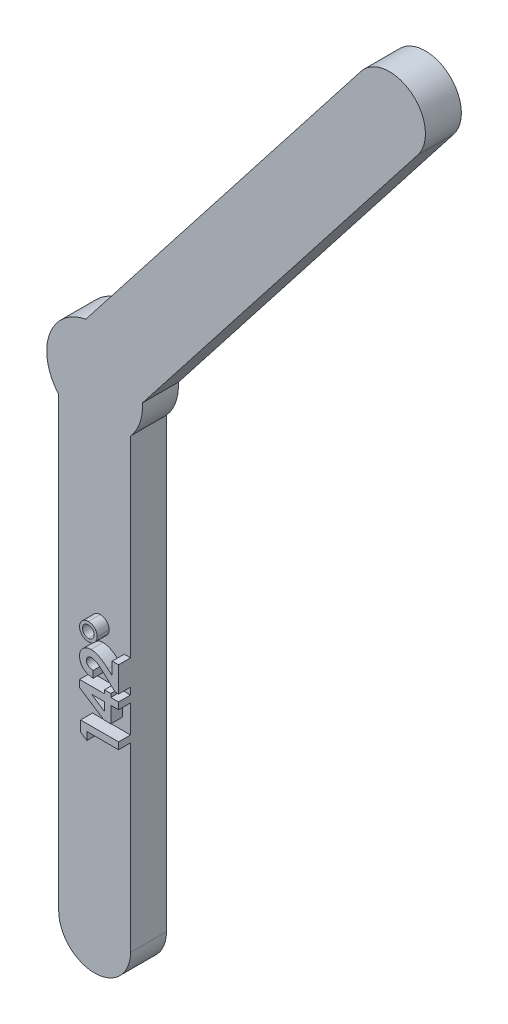
from build123d import *

# Parameters (mm, degrees)
BOSS_EXTRUDE1_DEPTH = 3
BOSS_EXTRUDE2_DEPTH = 1


with BuildPart() as part:
    # Sketch2 → Boss-Extrude1 (new body)
    with BuildSketch(Plane.XY):
        with BuildLine():
            Line((-3, -40), (-3, -2.645751311))
            ThreePointArc((-3, -2.645751311), (-3.782074302, 1.302272618), (-0.735145105, 3.93186491))
            Line((-0.735145105, 3.93186491), (22.262426752, 33.36741457))
            ThreePointArc((22.262426752, 33.36741457), (26.473443439, 33.884462405), (26.990491274, 29.673445718))
            Line((26.990491274, 29.673445718), (3.992919416, 0.237896059))
            ThreePointArc((3.992919416, 0.237896059), (3.782074302, -1.302272618), (3, -2.645751311))
            Line((3, -2.645751311), (3, -40))
            ThreePointArc((3, -40), (0, -43), (-3, -40))
        make_face()
    extrude(amount=BOSS_EXTRUDE1_DEPTH)

    # Sketch3 → Boss-Extrude2 (add)
    # profile 1 of 4: a face of its own
    with BuildSketch(Plane.XY.offset(3)):
        Polygon((-0.175, -25.154881865), (-0.175, -24.27399745), (3, -24.27399745), (3, -24.843869245), (0.354166667, -24.843869245), (0.354166667, -25.495151297), align=None)
    # profile 2 of 4: a face of its own
    with BuildSketch(Plane.XY.offset(3)):
        Polygon((-0.256410256, -21.977973813), (-0.256410256, -21.383933348), (1.819551282, -21.383933348), (1.819551282, -21.09899745), (2.348717949, -21.09899745), (2.348717949, -21.383933348), (3, -21.383933348), (3, -21.953805143), (2.348717949, -21.953805143), (2.348717949, -23.297074373), (1.77184996, -23.297074373), align=None)
        Polygon((1.819551282, -21.953805143), (0.738957332, -21.953805143), (1.819551282, -22.656604622), align=None, mode=Mode.SUBTRACT)
    # profile 3 of 4: a face of its own
    with BuildSketch(Plane.XY.offset(3)):
        with BuildLine():
            Line((0.883333333, -20.162779502), (0.883333333, -20.732651297))
            add(Edge.make_bspline(
                [(0.883333333, -20.732651297), (0.840225096, -20.730191074), (0.755994188, -20.725383947), (0.633653662, -20.706241436), (0.518027034, -20.680657038), (0.40946192, -20.646219807), (0.307912712, -20.60380263), (0.213715784, -20.552349795), (0.126196171, -20.493397498), (0.046888793, -20.425757446), (-0.024410951, -20.352174821), (-0.086743059, -20.272838264), (-0.138923185, -20.187973141), (-0.181726781, -20.098146926), (-0.21597517, -20.003712445), (-0.238860935, -19.903715573), (-0.254362753, -19.79903865), (-0.255719005, -19.727378184), (-0.256410256, -19.690854422)],
                knots=[0, 0, 0, 0, 1.198928049, 2.342633425, 3.435730849, 4.486331048, 5.502589352, 6.488331875, 7.46361919, 8.428949135, 9.378681775, 10.305958057, 11.226249248, 12.140413166, 13.066341608, 14.010670971, 14.986082777, 16, 16, 16, 16], degree=3))
            add(Edge.make_bspline(
                [(-0.256410256, -19.690854422), (-0.255105406, -19.646001889), (-0.252556912, -19.558400759), (-0.227944491, -19.43153247), (-0.1902546, -19.312410398), (-0.135496388, -19.202301662), (-0.066445841, -19.101397701), (0.016045912, -19.010259508), (0.112981004, -18.930664566), (0.22156795, -18.863233626), (0.336775889, -18.807471791), (0.455688105, -18.768021196), (0.575235528, -18.742227374), (0.655723183, -18.739469888), (0.695708133, -18.738100015)],
                knots=[0, 0, 0, 0, 1.075374184, 2.100304875, 3.089917907, 4.066149699, 5.039978333, 6.01615708, 7.006437042, 8.039858286, 9.077679641, 10.07047942, 11.041445745, 12, 12, 12, 12], degree=3))
            add(Edge.make_bspline(
                [(0.695708133, -18.738100015), (0.719894323, -18.738632687), (0.76857515, -18.739704825), (0.842241189, -18.747159544), (0.91727866, -18.758343098), (0.993623236, -18.77520516), (1.071296278, -18.796233582), (1.15053039, -18.821743906), (1.23087573, -18.852328775), (1.313238994, -18.887474255), (1.397877871, -18.929414737), (1.48610119, -18.978199927), (1.57781503, -19.035460826), (1.673918976, -19.099333418), (1.77294563, -19.172330469), (1.875994606, -19.252518354), (1.982903527, -19.34030072), (2.054398515, -19.402554777), (2.091130809, -19.434539317)],
                knots=[0, 0, 0, 0, 0.728277616, 1.465842947, 2.227925269, 3.011838508, 3.818735656, 4.650581052, 5.517389122, 6.406849312, 7.346234817, 8.360743166, 9.441530624, 10.601362564, 11.834937575, 13.145232671, 14.533293658, 16, 16, 16, 16], degree=3))
            Line((2.091130809, -19.434539317), (2.470833333, -19.765904502))
            Line((2.470833333, -19.765904502), (2.470833333, -18.697394886))
            Line((2.470833333, -18.697394886), (3, -18.697394886))
            Line((3, -18.697394886), (3, -20.814061553))
            Line((3, -20.814061553), (2.711247997, -20.814061553))
            Line((2.711247997, -20.814061553), (1.710792268, -19.874027498))
            add(Edge.make_bspline(
                [(1.710792268, -19.874027498), (1.681608954, -19.846810666), (1.625089529, -19.794099733), (1.542079999, -19.719104506), (1.46332294, -19.651215475), (1.38790503, -19.591950629), (1.318379822, -19.537724275), (1.252118997, -19.492359941), (1.190988578, -19.452853164), (1.116473028, -19.411584162), (1.028271209, -19.371490235), (0.9267219, -19.334724743), (0.829596088, -19.312538281), (0.766193513, -19.309452269), (0.735777244, -19.307971809)],
                knots=[0, 0, 0, 0, 1.246192343, 2.413505005, 3.49357156, 4.492416076, 5.408771964, 6.246246772, 6.999304986, 7.680960093, 8.904522682, 10.020616941, 11.0504258, 12, 12, 12, 12], degree=3))
            add(Edge.make_bspline(
                [(0.735777244, -19.307971809), (0.706350798, -19.309075792), (0.649332342, -19.311214936), (0.568223891, -19.334722394), (0.494788469, -19.371140964), (0.431220409, -19.422459871), (0.378982318, -19.484623141), (0.340129094, -19.556458639), (0.317710962, -19.637380694), (0.314905012, -19.694108596), (0.313461538, -19.723291321)],
                knots=[0, 0, 0, 0, 1.062038974, 2.057870785, 3.028805853, 4.01125022, 4.991535629, 5.949134679, 6.94496649, 8, 8, 8, 8], degree=3))
            add(Edge.make_bspline(
                [(0.313461538, -19.723291321), (0.313994775, -19.738367488), (0.315044537, -19.768047344), (0.322032517, -19.811674413), (0.334348102, -19.853188704), (0.350849253, -19.893052293), (0.372721647, -19.930839746), (0.399682857, -19.966455751), (0.431047738, -20.000275568), (0.466718216, -20.032144085), (0.50652648, -20.061148596), (0.550108963, -20.086910297), (0.597438611, -20.108210934), (0.647890602, -20.12696479), (0.70200683, -20.141428661), (0.759463417, -20.151960153), (0.820166887, -20.159966543), (0.861894815, -20.161824791), (0.883333333, -20.162779502)],
                knots=[0, 0, 0, 0, 0.903469896, 1.778625579, 2.63899355, 3.493148037, 4.358286772, 5.247621495, 6.164656832, 7.118446693, 8.109501108, 9.111810964, 10.146451449, 11.215617525, 12.33435995, 13.498009769, 14.714554818, 16, 16, 16, 16], degree=3))
        make_face()
    # profile 4 of 4: a face of its own
    with BuildSketch(Plane.XY.offset(3)):
        with BuildLine():
            add(Edge.make_bspline(
                [(0.476282051, -16.824958989), (0.501543872, -16.825505484), (0.55122174, -16.826580176), (0.624352745, -16.837013476), (0.694208258, -16.854492691), (0.761803607, -16.876903338), (0.825395964, -16.908042089), (0.886396731, -16.944903837), (0.943669883, -16.989402672), (0.9978957, -17.039014969), (1.047295391, -17.093515132), (1.090947065, -17.151405488), (1.127096601, -17.212864468), (1.157366856, -17.276577248), (1.180332148, -17.343408663), (1.196689885, -17.412864586), (1.20741609, -17.485236986), (1.208449037, -17.534503871), (1.208974359, -17.559559349)],
                knots=[0, 0, 0, 0, 1.048753193, 2.062393874, 3.059725798, 4.03711221, 5.013824111, 5.993903926, 6.992478922, 8.020738441, 9.043061753, 10.043343452, 11.026424807, 11.999358773, 12.968420071, 13.955122655, 14.960044262, 16, 16, 16, 16], degree=3))
            add(Edge.make_bspline(
                [(1.208974359, -17.559559349), (1.208454225, -17.584616682), (1.207431478, -17.633887214), (1.196631189, -17.706233128), (1.180530583, -17.775855144), (1.156529218, -17.842391691), (1.126678292, -17.90615653), (1.090260147, -17.967072817), (1.046482503, -18.024600993), (0.996781055, -18.078582797), (0.942375086, -18.128107638), (0.88420218, -18.171482912), (0.823225465, -18.208946116), (0.758107997, -18.237837437), (0.69067286, -18.261947038), (0.619758864, -18.27798784), (0.545943315, -18.288833106), (0.495615647, -18.289833085), (0.469921875, -18.290343604)],
                knots=[0, 0, 0, 0, 1.037227242, 2.039512271, 3.023626077, 3.993053151, 4.963434463, 5.936395473, 6.927031705, 7.952593414, 8.972234493, 9.969891786, 10.954906455, 11.929570282, 12.915563215, 13.916770353, 14.936449251, 16, 16, 16, 16], degree=3))
            add(Edge.make_bspline(
                [(0.469921875, -18.290343604), (0.445290866, -18.289811451), (0.396869022, -18.288765297), (0.325492116, -18.278103661), (0.256787066, -18.261182775), (0.190979117, -18.23681523), (0.128167681, -18.205730248), (0.067236284, -18.169180135), (0.010175979, -18.123937412), (-0.044275745, -18.073515722), (-0.093962638, -18.018218509), (-0.137555056, -17.95952238), (-0.173973759, -17.89802202), (-0.203993097, -17.834134423), (-0.227847104, -17.767768562), (-0.244158222, -17.698411219), (-0.254789074, -17.626671533), (-0.255866772, -17.577830012), (-0.256410256, -17.553199173)],
                knots=[0, 0, 0, 0, 1.027628768, 2.020204677, 3.0054932, 3.977172113, 4.942988595, 5.928118098, 6.937247537, 7.976812879, 9.023474825, 10.036014018, 11.024160528, 12.002107364, 12.979092523, 13.962271943, 14.972371232, 16, 16, 16, 16], degree=3))
            add(Edge.make_bspline(
                [(-0.256410256, -17.553199173), (-0.255881051, -17.528566172), (-0.254836181, -17.479930408), (-0.244068832, -17.408427146), (-0.227959354, -17.339440503), (-0.203981879, -17.27352423), (-0.173948227, -17.210285117), (-0.137706982, -17.149501332), (-0.093944483, -17.091941849), (-0.043999627, -17.038019265), (0.009956511, -16.987787182), (0.068273488, -16.944627592), (0.128824771, -16.907104674), (0.192846684, -16.877455064), (0.259342082, -16.853394895), (0.329176204, -16.837233977), (0.401748506, -16.826543556), (0.451226198, -16.825491671), (0.476282051, -16.824958989)],
                knots=[0, 0, 0, 0, 1.02774298, 2.029191086, 3.012479778, 3.981238486, 4.951290381, 5.931946007, 6.930416638, 7.964088953, 8.997761269, 10.003308488, 10.98854748, 11.966603007, 12.943696749, 13.935593372, 14.954569896, 16, 16, 16, 16], degree=3))
        make_face()
        with BuildLine():
            add(Edge.make_bspline(
                [(0.479462139, -17.069189758), (0.462471258, -17.069424264), (0.428972226, -17.069886612), (0.379883793, -17.077505977), (0.332524379, -17.088023775), (0.287283463, -17.10328392), (0.24427911, -17.123234284), (0.203398935, -17.147571829), (0.164484674, -17.176174899), (0.128492582, -17.209237523), (0.095853701, -17.245103846), (0.066652511, -17.282897251), (0.042455186, -17.323086522), (0.023016589, -17.365273093), (0.006315159, -17.408801858), (-0.003707976, -17.454711924), (-0.01154919, -17.502263298), (-0.011966436, -17.534718897), (-0.012179487, -17.55129112)],
                knots=[0, 0, 0, 0, 1.061159961, 2.092171217, 3.098605391, 4.092036902, 5.070589041, 6.057187883, 7.061962211, 8.084674938, 9.107387665, 10.090954379, 11.06617917, 12.032717429, 12.99305519, 13.973669989, 14.965331307, 16, 16, 16, 16], degree=3))
            add(Edge.make_bspline(
                [(-0.012179487, -17.55129112), (-0.01157068, -17.568051412), (-0.01036426, -17.601263796), (-0.004409395, -17.650200831), (0.007572839, -17.69685371), (0.022606002, -17.742054962), (0.043122897, -17.784898142), (0.067542797, -17.826391236), (0.096744971, -17.865435361), (0.129769422, -17.902214665), (0.165718261, -17.935960463), (0.204573602, -17.964950546), (0.244977971, -17.990352408), (0.287582445, -18.010455361), (0.331832846, -18.026567734), (0.377821945, -18.038209426), (0.425871214, -18.044356322), (0.458458137, -18.045521173), (0.475010016, -18.046112835)],
                knots=[0, 0, 0, 0, 1.042034071, 2.064906527, 3.055369705, 4.030203466, 5.020228521, 6.000742353, 7.017744738, 8.043920206, 9.069249762, 10.075703201, 11.051782302, 12.029903876, 12.99669358, 13.974371501, 14.971122288, 16, 16, 16, 16], degree=3))
            add(Edge.make_bspline(
                [(0.475010016, -18.046112835), (0.491349767, -18.045520146), (0.523514051, -18.044353455), (0.570936909, -18.038223162), (0.616468237, -18.026465839), (0.660506807, -18.010425399), (0.703332854, -17.990458383), (0.743356347, -17.964229259), (0.782721478, -17.935019181), (0.819574977, -17.900938323), (0.853594861, -17.864058718), (0.883277913, -17.824563201), (0.908722399, -17.783622403), (0.929101491, -17.740636346), (0.945194342, -17.696373754), (0.956841315, -17.650387952), (0.962986781, -17.60233779), (0.964151827, -17.56975099), (0.96474359, -17.553199173)],
                knots=[0, 0, 0, 0, 1.017878107, 2.003660885, 2.970612419, 3.939454555, 4.919652619, 5.904816436, 6.913406512, 7.969270601, 9.02513469, 10.033724766, 11.041277553, 12.021475617, 12.990317753, 13.970071221, 14.968938047, 16, 16, 16, 16], degree=3))
            add(Edge.make_bspline(
                [(0.96474359, -17.553199173), (0.964515736, -17.536840687), (0.964066668, -17.504600367), (0.956359019, -17.457448889), (0.946146284, -17.411789288), (0.929505189, -17.368485652), (0.910263551, -17.326033898), (0.884925795, -17.286252494), (0.856415485, -17.247396305), (0.822504018, -17.212069657), (0.787116244, -17.177952839), (0.747777121, -17.149765554), (0.707718654, -17.124520148), (0.665616684, -17.10387006), (0.621397497, -17.089062601), (0.575848465, -17.07693948), (0.528165265, -17.071009446), (0.49579822, -17.069800121), (0.479462139, -17.069189758)],
                knots=[0, 0, 0, 0, 1.029744634, 2.029484694, 3.00508751, 3.97324883, 4.947661161, 5.937798898, 6.940036528, 7.980134083, 9.020231638, 10.033191535, 11.023329272, 12.003497406, 12.979740652, 13.958541426, 14.969648588, 16, 16, 16, 16], degree=3))
        make_face(mode=Mode.SUBTRACT)
    extrude(amount=BOSS_EXTRUDE2_DEPTH)


solid = part.part
